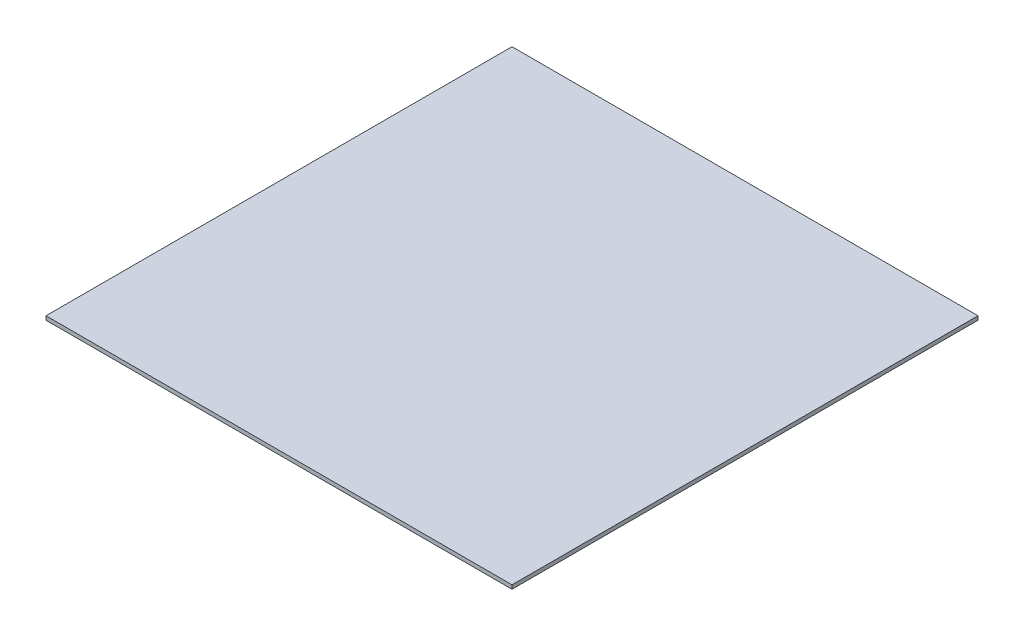
from build123d import *

# Parameters (mm, degrees)
SKETCH1_W           = 762
SKETCH1_H           = 762
BOSS_EXTRUDE1_DEPTH = 6.35


with BuildPart() as part:
    # Sketch1 → Boss-Extrude1 (new body)
    with BuildSketch(Plane(origin=(0, 0, 0), x_dir=(1, 0, 0), z_dir=(0, 1, 0))):
        Rectangle(SKETCH1_W, SKETCH1_H)
    extrude(amount=BOSS_EXTRUDE1_DEPTH)


solid = part.part
